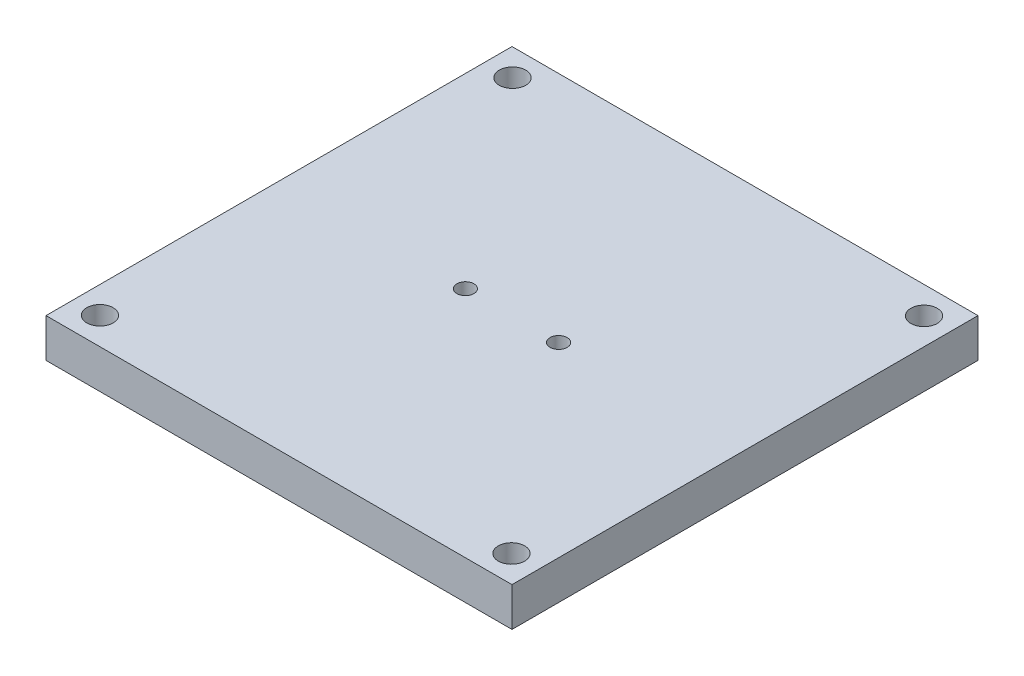
from build123d import *

# Parameters (mm, degrees)
SKETCH_3_W      = 60
SKETCH_3_H      = 60
SKETCH_3_R      = 1.1
SKETCH_3_R_2    = 1.7
EXTRUDE_1_DEPTH = 5


with BuildPart() as part:
    # 草图3 → 凸台-拉伸1 (new body)
    with BuildSketch(Plane(origin=(0, 0, 0), x_dir=(1, 0, 0), z_dir=(0, 1, 0))):
        with Locations((30, 30)):
            Rectangle(SKETCH_3_W, SKETCH_3_H)
        with Locations(Location((36, 30, 0), (0, 0, 270))):
            Circle(SKETCH_3_R, mode=Mode.SUBTRACT)
        with Locations(Location((24, 30, 0), (0, 0, 90))):
            Circle(SKETCH_3_R, mode=Mode.SUBTRACT)
        with Locations(Location((3.505302868, 56.560243153, 0), (0, 0, 270))):
            Circle(SKETCH_3_R_2, mode=Mode.SUBTRACT)
        with Locations(Location((56.560243153, 56.494697132, 0), (0, 0, 270))):
            Circle(SKETCH_3_R_2, mode=Mode.SUBTRACT)
        with Locations(Location((56.494697132, 3.439756847, 0), (0, 0, 270))):
            Circle(SKETCH_3_R_2, mode=Mode.SUBTRACT)
        with Locations(Location((3.439756847, 3.505302868, 0), (0, 0, 270))):
            Circle(SKETCH_3_R_2, mode=Mode.SUBTRACT)
    extrude(amount=EXTRUDE_1_DEPTH)


solid = part.part
